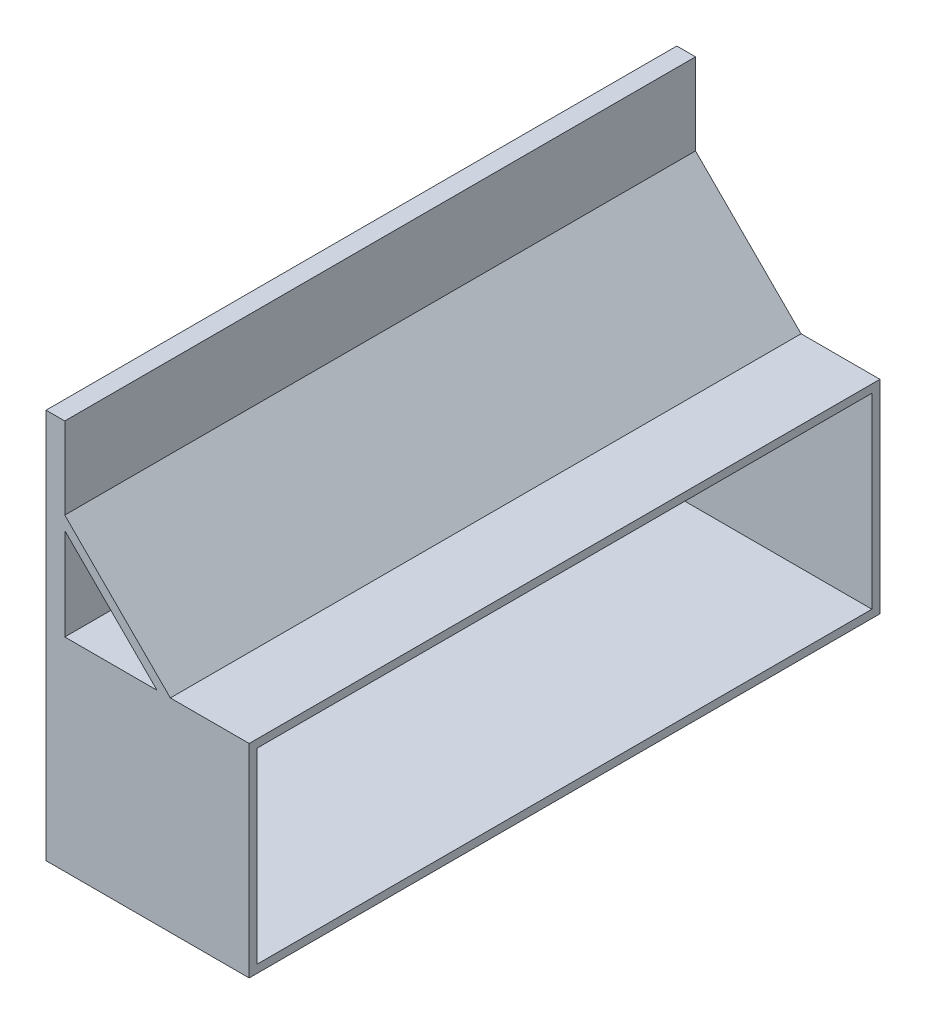
from build123d import *

# Parameters (mm, degrees)
SKETCH_1_W          = 76
SKETCH_1_H          = 76
EXTRUDE_1_DEPTH     = 236
SKETCH_3_W          = 230
SKETCH_3_H          = 70
CUT_EXTRUDE_1_DEPTH = 130.085755737
SKETCH_4_W          = 7
SKETCH_4_H          = 236
EXTRUDE_2_DEPTH     = 70
EXTRUDE_5_DEPTH     = 236


with BuildPart() as part:
    # 草圖1 → 填料-伸長1 (new body)
    with BuildSketch(Plane.XY):
        with Locations((-8.891608392, -8.891608392)):
            Rectangle(SKETCH_1_W, SKETCH_1_H)
    extrude(amount=EXTRUDE_1_DEPTH)

    # 草圖3 → 除料-伸長1 (cut)
    with BuildSketch(Plane.ZY.offset(46.891608392)):
        with Locations((118, -8.891608392)):
            Rectangle(SKETCH_3_W, SKETCH_3_H)
    extrude(amount=-CUT_EXTRUDE_1_DEPTH, mode=Mode.SUBTRACT)

    # 草圖4 → 填料-伸長2 (add)
    with BuildSketch(Plane(origin=(0, 29.108391608, 0), x_dir=(1, 0, 0), z_dir=(0, 1, 0))):
        with Locations((-43.391608392, -118)):
            Rectangle(SKETCH_4_W, SKETCH_4_H)
    extrude(amount=EXTRUDE_2_DEPTH)

    # 草圖5 → 填料-伸長5 (add)
    with BuildSketch(Plane.XY.offset(236)):
        Polygon((-39.891608392, 63.608391608), (-5.391608392, 29.108391608), (-0.391608392, 29.108391608), (-39.891608392, 68.608391608), align=None)
    extrude(amount=-EXTRUDE_5_DEPTH)


solid = part.part
